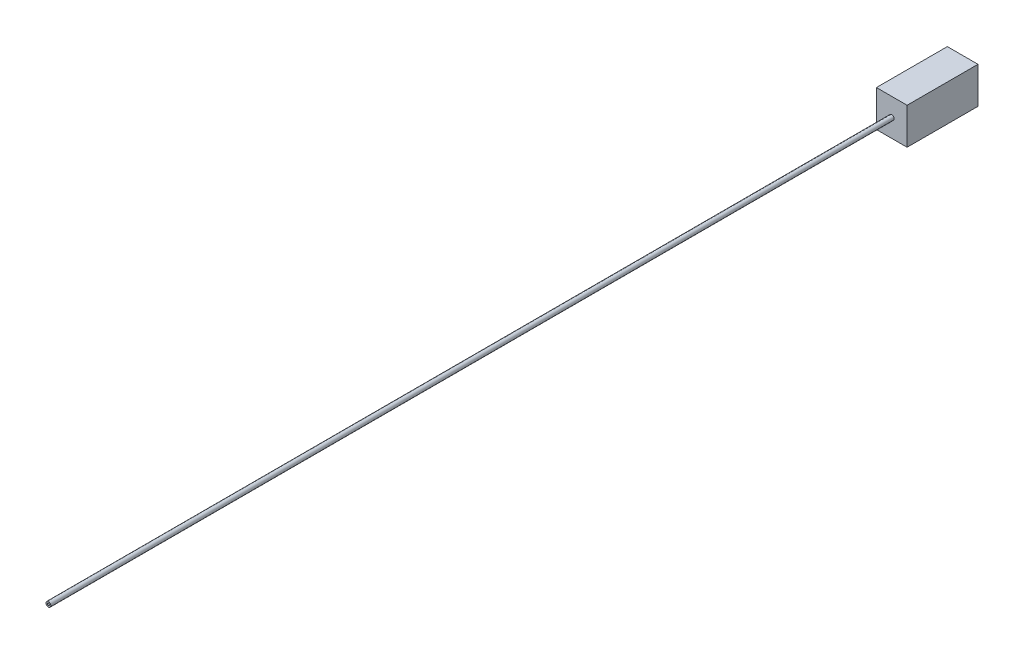
from build123d import *

# Parameters (mm, degrees)
ESBO_O1_W                = 8
ESBO_O1_H                = 9.5
RESSALTO_EXTRUS_O1_DEPTH = 18.5
ESBO_O2_R                = 0.625
ESBO_O2_R_2              = 0.25
RESSALTO_EXTRUS_O2_DEPTH = 220
CORTE_EXTRUS_O1_START    = -230
ESBO_O2_3_R              = 0.25
CORTE_EXTRUS_O1_DEPTH    = 230


with BuildPart() as part:
    # Esboço1 → Ressalto-extrusão1 (new body)
    with BuildSketch(Plane.XY):
        Rectangle(ESBO_O1_W, ESBO_O1_H)
    extrude(amount=RESSALTO_EXTRUS_O1_DEPTH)

    # Esboço2 → Ressalto-extrusão2 (add)
    with BuildSketch(Plane.XY.offset(18.5)):
        Circle(ESBO_O2_R)
        Circle(ESBO_O2_R_2, mode=Mode.SUBTRACT)
    extrude(amount=RESSALTO_EXTRUS_O2_DEPTH)

    # Esboço2<3> → Corte-extrusão1 (cut)
    with BuildSketch(Plane.XY.offset(18.5).offset(CORTE_EXTRUS_O1_START)):
        Circle(ESBO_O2_3_R)
    extrude(amount=CORTE_EXTRUS_O1_DEPTH, mode=Mode.SUBTRACT)


solid = part.part
